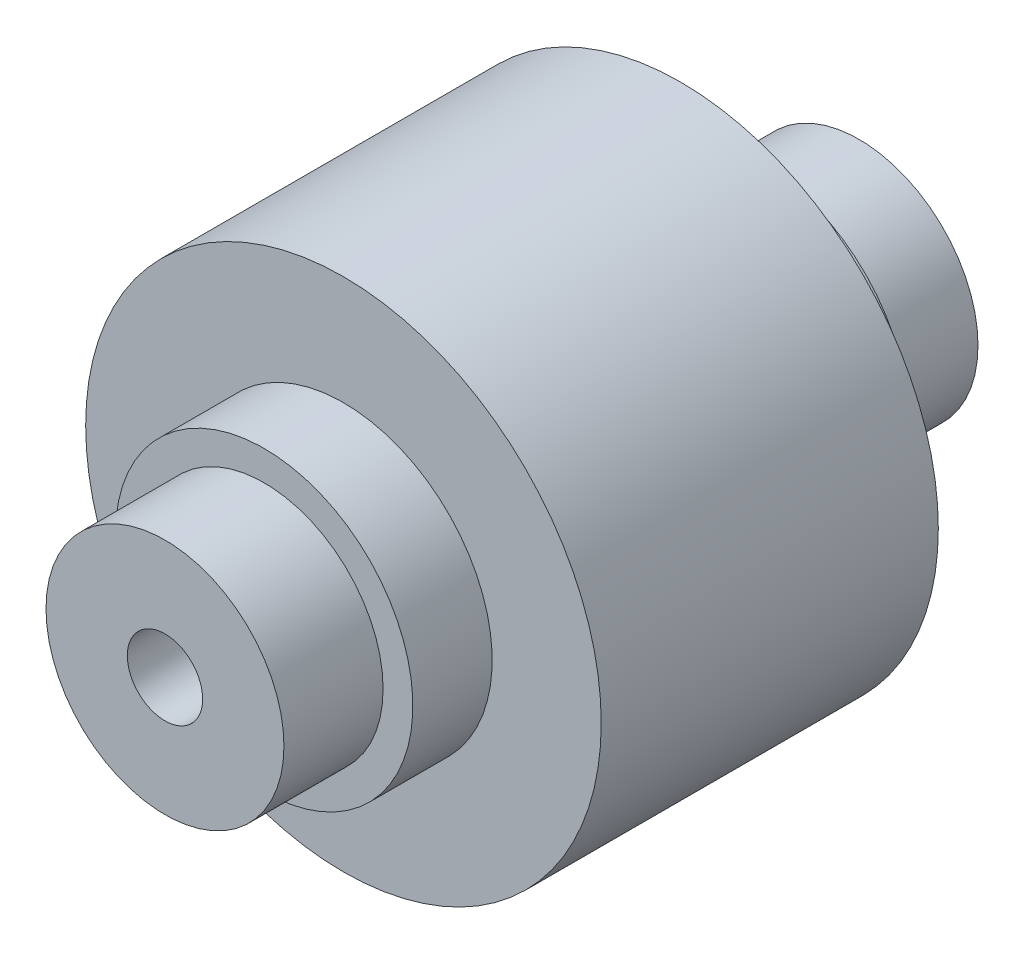
from build123d import *

# Parameters (mm, degrees)
SKETCH_2_R          = 1.9
CUT_EXTRUDE_1_DEPTH = 36


with BuildPart() as part:
    # 草图1 → 旋转1 (revolve)
    with BuildSketch(Plane(origin=(0, 0, 0), x_dir=(1, 0, 0), z_dir=(0, 1, 0)), mode=Mode.PRIVATE) as revolve_1_sk:
        Polygon((0, -1e-09), (0, -35), (6, -35), (6, -30), (7.5, -30), (7.5, -26), (9, -26), (13, -26), (13, -9), (9, -9), (7.5, -9), (7.5, -5), (6, -5), (6, -1e-09), align=None)
    revolve(revolve_1_sk.sketch.rotate(Axis((0, 0, 1e-09), (0, 0, 1)), 180), axis=Axis((0, 0, 1e-09), (0, 0, 1)))

    # 草图2 → 切除-拉伸1 (cut)
    with BuildSketch(Plane.XY.offset(35)):
        Circle(SKETCH_2_R)
    extrude(amount=-CUT_EXTRUDE_1_DEPTH, mode=Mode.SUBTRACT)


solid = part.part
